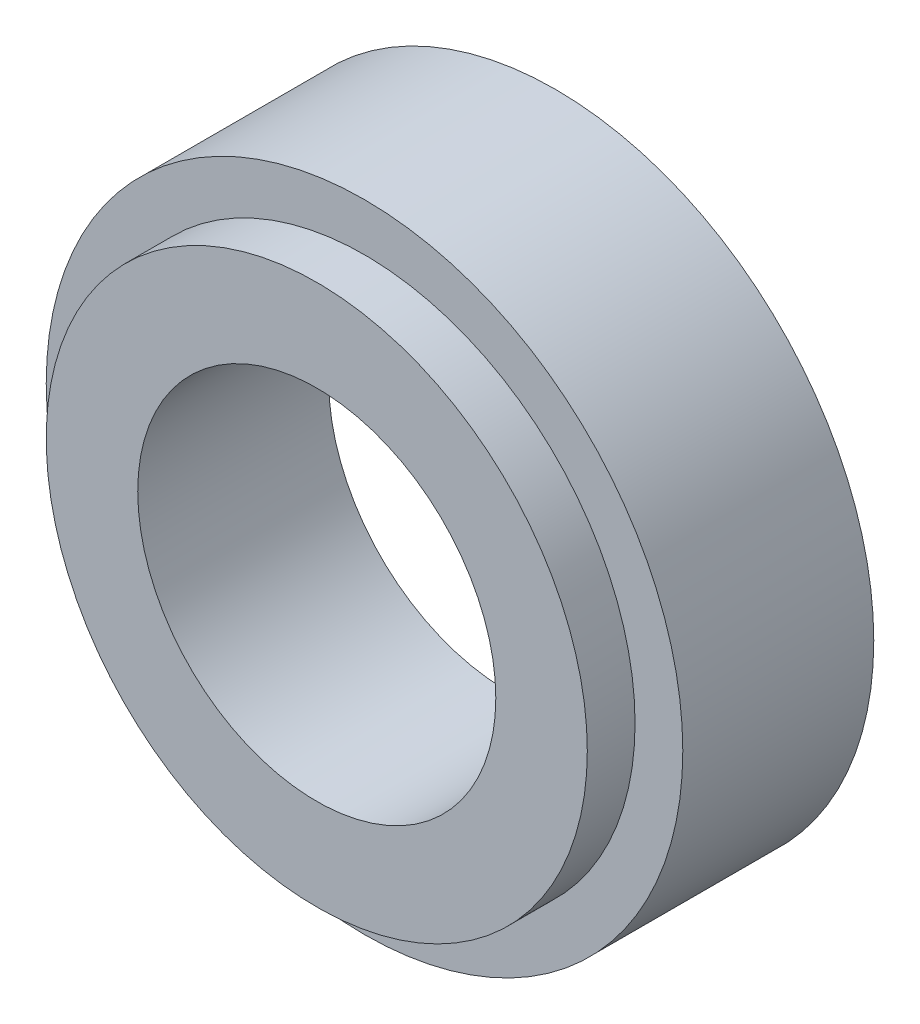
from build123d import *

# Parameters (mm, degrees)
SKETCH_1_R          = 20
EXTRUDE_1_DEPTH     = 18
CUT_EXTRUDE_START   = -3
SKETCH_2_R          = 20
CUT_EXTRUDE_1_DEPTH = 3
SKETCH_5_R          = 20
SKETCH_5_R_2        = 17
CUT_EXTRUDE_4_DEPTH = 3
SKETCH_6_R          = 11.25
CUT_EXTRUDE_5_DEPTH = 50
SKETCH_7_R          = 18
CUT_EXTRUDE_6_DEPTH = 3


with BuildPart() as part:
    # 草图1 → 拉伸1 (new body)
    with BuildSketch(Plane.XY):
        Circle(SKETCH_1_R)
    extrude(amount=EXTRUDE_1_DEPTH)

    # 草图2 → 切除-拉伸1 (cut)
    with BuildSketch(Plane.XY.offset(18).offset(CUT_EXTRUDE_START)):
        Circle(SKETCH_2_R)
    extrude(amount=CUT_EXTRUDE_1_DEPTH, mode=Mode.SUBTRACT)

    # 草图5 → 切除-拉伸4 (cut)
    with BuildSketch(Plane.XY.offset(15).offset(CUT_EXTRUDE_START)):
        Circle(SKETCH_5_R)
        Circle(SKETCH_5_R_2, mode=Mode.SUBTRACT)
    extrude(amount=CUT_EXTRUDE_4_DEPTH, mode=Mode.SUBTRACT)

    # 草图6 → 切除-拉伸5 (cut)
    with BuildSketch(Plane(origin=(0, 0, 0), x_dir=(-1, 0, 0), z_dir=(0, 0, -1))):
        Circle(SKETCH_6_R)
    extrude(amount=-CUT_EXTRUDE_5_DEPTH, mode=Mode.SUBTRACT)

    # 草图7 → 切除-拉伸6 (cut)
    with BuildSketch(Plane(origin=(0, 0, 0), x_dir=(-1, 0, 0), z_dir=(0, 0, -1))):
        Circle(SKETCH_7_R)
    extrude(amount=-CUT_EXTRUDE_6_DEPTH, mode=Mode.SUBTRACT)


solid = part.part
